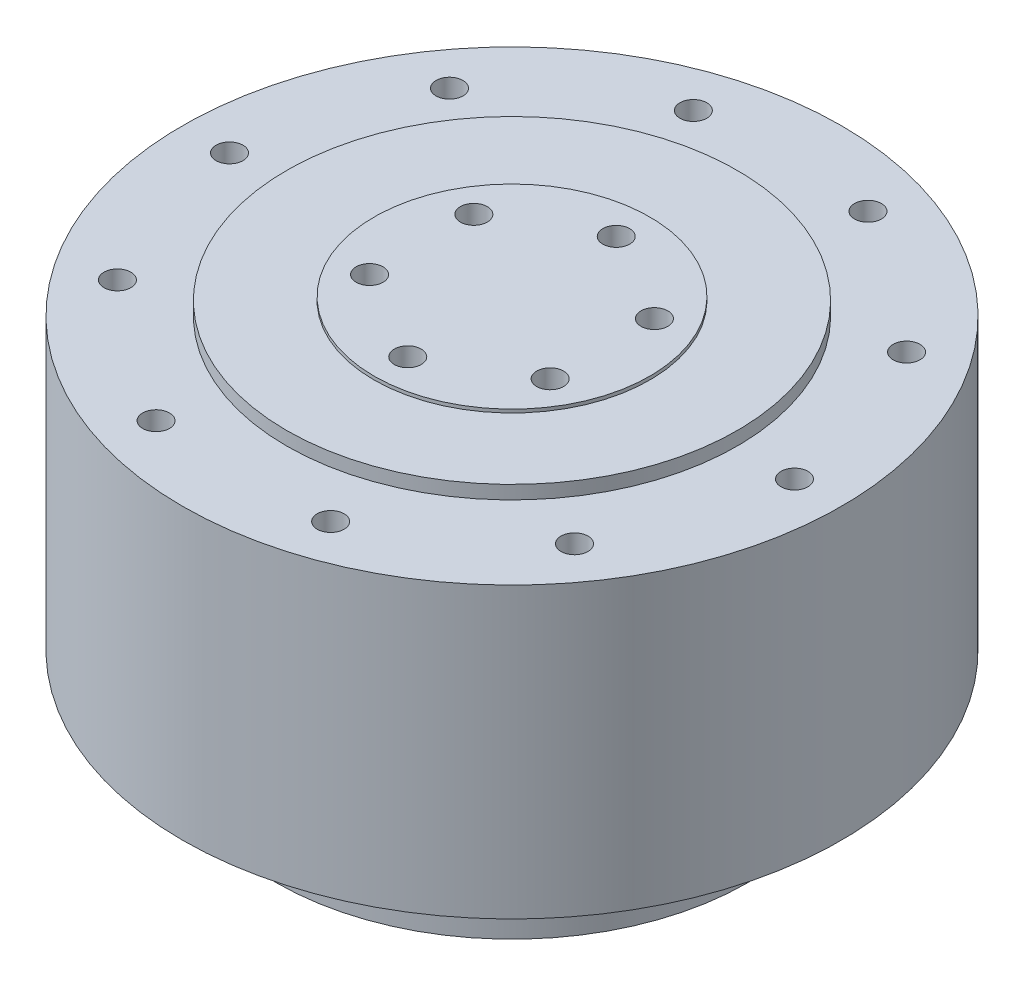
from build123d import *

# Parameters (mm, degrees)
SKETCH_1_R               = 49
EXTRUDE_1_DEPTH          = 43
SKETCH_2_R               = 33.5
EXTRUDE_2_DEPTH          = 2
EXTRUDE_3_DEPTH          = 12.5
SKETCH_4_R               = 20.5
EXTRUDE_4_DEPTH          = 0.5
SKETCH_5_R               = 2
CUT_EXTRUDE_1_DEPTH      = 5
PATTERN_CIRCULAR_1_COUNT = 6
SKETCH_6_R               = 2
CUT_EXTRUDE_2_DEPTH      = 5
PATTERN_CIRCULAR_2_COUNT = 10
CUT_EXTRUDE_START        = -5
SKETCH_7_R               = 2
CUT_EXTRUDE_3_DEPTH      = 5
PATTERN_CIRCULAR_3_COUNT = 10


with BuildPart() as part:
    # 草圖1 → 填料-伸長1 (new body)
    with BuildSketch(Plane(origin=(0, 0, 0), x_dir=(1, 0, 0), z_dir=(0, 1, 0))):
        with Locations(Location((0, 0, 0), (0, 0, 270))):
            Circle(SKETCH_1_R)
    extrude(amount=EXTRUDE_1_DEPTH)

    # 草圖2 → 填料-伸長2 (add)
    with BuildSketch(Plane(origin=(0, 43, 0), x_dir=(1, 0, 0), z_dir=(0, 1, 0))):
        with Locations(Location((0, 0, 0), (0, 0, 270))):
            Circle(SKETCH_2_R)
    extrude(amount=EXTRUDE_2_DEPTH)

    # 草圖3 → 填料-伸長3 (add)
    with BuildSketch(Plane.XZ):
        with BuildLine():
            Line((-16.624078922, -30.8), (16.624078922, -30.8))
            ThreePointArc((16.624078922, -30.8), (0, 35), (-16.624078922, -30.8))
        make_face()
    extrude(amount=EXTRUDE_3_DEPTH)

    # 草圖4 → 填料-伸長4 (add)
    with BuildSketch(Plane(origin=(0, 45, 0), x_dir=(1, 0, 0), z_dir=(0, 1, 0))):
        with Locations(Location((0, 0, 0), (0, 0, 270))):
            Circle(SKETCH_4_R)
    extrude(amount=EXTRUDE_4_DEPTH)

    # 草圖5 → 除料-伸長1 (cut)
    with BuildSketch(Plane(origin=(0, 45.5, 0), x_dir=(1, 0, 0), z_dir=(0, 1, 0))):
        with Locations(Location((0, 15.5, 0), (0, 0, 270))):
            Circle(SKETCH_5_R)
    cut_extrude_1 = extrude(amount=-CUT_EXTRUDE_1_DEPTH, mode=Mode.SUBTRACT)

    # 環狀複製排列1: 除料-伸長1 ×6 about axis
    pattern_circular_1_axis = Axis((0, 0, 0), (0, 1, 0))
    for i in range(1, PATTERN_CIRCULAR_1_COUNT):
        add(cut_extrude_1.rotate(pattern_circular_1_axis, i * 360 / PATTERN_CIRCULAR_1_COUNT), mode=Mode.SUBTRACT)

    # 草圖6 → 除料-伸長2 (cut)
    with BuildSketch(Plane(origin=(0, 43, 0), x_dir=(1, 0, 0), z_dir=(0, 1, 0))):
        with Locations(Location((-42, 0, 0), (0, 0, 270))):
            Circle(SKETCH_6_R)
    cut_extrude_2 = extrude(amount=-CUT_EXTRUDE_2_DEPTH, mode=Mode.SUBTRACT)

    # 環狀複製排列2: 除料-伸長2 ×10 about axis
    pattern_circular_2_axis = Axis((0, 0, 0), (0, 1, 0))
    for i in range(1, PATTERN_CIRCULAR_2_COUNT):
        add(cut_extrude_2.rotate(pattern_circular_2_axis, i * 360 / PATTERN_CIRCULAR_2_COUNT), mode=Mode.SUBTRACT)

    # 草圖7 → 除料-伸長3 (cut)
    with BuildSketch(Plane.XZ.offset(CUT_EXTRUDE_START)):
        with Locations(Location((42, 0, 0), (0, 0, 270))):
            Circle(SKETCH_7_R)
    cut_extrude_3 = extrude(amount=CUT_EXTRUDE_3_DEPTH, mode=Mode.SUBTRACT)

    # 環狀複製排列3: 除料-伸長3 ×10 about axis
    pattern_circular_3_axis = Axis((0, 0, 0), (0, 1, 0))
    for i in range(1, PATTERN_CIRCULAR_3_COUNT):
        add(cut_extrude_3.rotate(pattern_circular_3_axis, i * 360 / PATTERN_CIRCULAR_3_COUNT), mode=Mode.SUBTRACT)


solid = part.part
